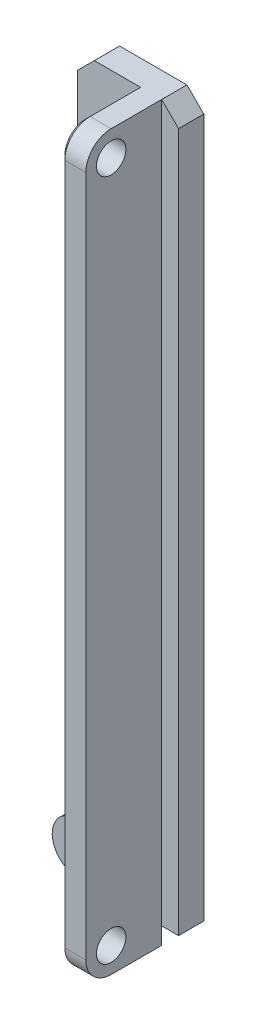
from build123d import *

# Parameters (mm, degrees)
EXTRUDE_1_DEPTH             = 3
SKETCH_2_W                  = 3
SKETCH_2_H                  = 72.000001073
EXTRUDE_2_DEPTH             = 1.5
CUT_EXTRUDE_1_DEPTH         = 73.753007862
SKETCH_4_W                  = 1.5
SKETCH_4_H                  = 69.000001073
CUT_EXTRUDE_2_DEPTH         = 73.753007862
EXTRUDE_3_DEPTH             = 3
DRAFT_1_ANGLE               = 45
HOLE_WIZARD_2_7_2_7_1_D     = 3.5
HOLE_WIZARD_2_7_2_7_1_DEPTH = 5.000000075
FILLET_1_R                  = 3
CHAMFER_1_SIZE              = 2.000001073
CHAMFER_1_SIZE2             = 2
CHAMFER_2_SIZE              = 2
CHAMFER_2_SIZE2             = 2.000001073
CHAMFER_4_SIZE              = 0.5


with BuildPart() as part:
    # ｽｹｯﾁ1 → ﾎﾞｽ - 押し出し1 (new body)
    with BuildSketch(Plane.XY.offset(-6)):
        with BuildLine():
            Line((5.000000075, 72.00000107), (-6.999999925, 72.00000107))
            Line((-6.999999925, 72.00000107), (-6.999999925, -7))
            ThreePointArc((-6.999999925, -7), (-9.999999925, -10), (-6.999999925, -13))
            Line((-6.999999925, -13), (5.000000075, -13))
            Line((5.000000075, -13), (5.000000075, 72.00000107))
        make_face()
    extrude(amount=-EXTRUDE_1_DEPTH)

    # ｽｹｯﾁ2 → ﾎﾞｽ - 押し出し2 (add)
    with BuildSketch(Plane.ZY.offset(6.999999925)):
        with Locations((-7.5, 36.000000537)):
            Rectangle(SKETCH_2_W, SKETCH_2_H)
    extrude(amount=EXTRUDE_2_DEPTH)

    # ｽｹｯﾁ3 → ｶｯﾄ - 押し出し1 (cut, through all)
    with BuildSketch(Plane(origin=(0, 0, -9), x_dir=(-1, 0, 0), z_dir=(0, 0, -1))):
        Polygon((3, -13), (3, 15), (4.5, 15), (4.5, 17), (0, 17), (0, -13), align=None)
    extrude(amount=-CUT_EXTRUDE_1_DEPTH, mode=Mode.SUBTRACT)

    # ｽｹｯﾁ4 → ｶｯﾄ - 押し出し2 (cut, through all)
    with BuildSketch(Plane.XY.offset(-6)):
        with Locations((-7.749999925, 37.500000537)):
            Rectangle(SKETCH_4_W, SKETCH_4_H)
    extrude(amount=-CUT_EXTRUDE_2_DEPTH, mode=Mode.SUBTRACT)

    # ｽｹｯﾁ5 → ﾎﾞｽ - 押し出し3 (add)
    with BuildSketch(Plane(origin=(0, 0, 0), x_dir=(0, -1, 0), z_dir=(-1, 0, 0))):
        Polygon((-72.000001073, 3), (-72.000001073, -3), (-72.000001073, -6), (14.999998927, -6), (14.999998927, 3), align=None)
    extrude(amount=-EXTRUDE_3_DEPTH)

    # 抜き勾配1
    draft_1_faces = [part.faces().sort_by_distance(p)[0] for p in [
        (-7.749999925, 3, -7.5),
    ]]
    draft(draft_1_faces, Plane(origin=(-6.999999925, 3, -9), x_dir=(0, -1, 0), z_dir=(-1, 0, 0)), DRAFT_1_ANGLE)

    # Ø2.7 (2.7) 直径の穴1
    with Locations(Plane.ZY):
        with Locations((0, 69.000001073), (0, -11.999998927)):
            Hole(HOLE_WIZARD_2_7_2_7_1_D / 2, depth=HOLE_WIZARD_2_7_2_7_1_DEPTH)

    # ﾌｨﾚｯﾄ1
    fillet_1_edges = [part.edges().sort_by_distance(p)[0] for p in [
        (1.5, 72.000001073, 3),
        (1.5, -14.999998927, 3),
    ]]
    fillet(fillet_1_edges, radius=FILLET_1_R)

    # 面取り1
    chamfer_1_edges = [part.edges().sort_by_distance(p)[0] for p in [
        (-6.999999925, 72.000001073, -7.5),
    ]]
    chamfer_1_side = [part.faces().sort_by_distance(p)[0] for p in [
        (1.5, 72.00000107, -0.15),
    ]]
    chamfer(chamfer_1_edges, length=CHAMFER_1_SIZE, length2=CHAMFER_1_SIZE2, reference=chamfer_1_side[0])

    # 面取り2
    chamfer_2_edges = [part.edges().sort_by_distance(p)[0] for p in [
        (5.000000075, 72.00000107, -7.5),
    ]]
    chamfer_2_side = [part.faces().sort_by_distance(p)[0] for p in [
        (0.56250042, 72.00000107, -5.812499887),
    ]]
    chamfer(chamfer_2_edges, length=CHAMFER_2_SIZE, length2=CHAMFER_2_SIZE2, reference=chamfer_2_side[0])

    # 面取り4
    chamfer_4_edges = [part.edges().sort_by_distance(p)[0] for p in [
        (0, -14.999998927, -3),
        (0, 28.500001071, 3),
        (0, 72.000001073, -3),
        (0, -14.121319271, 2.121320344),
        (0, 71.121321414, 2.121320344),
    ]]
    chamfer(chamfer_4_edges, length=CHAMFER_4_SIZE)


solid = part.part
